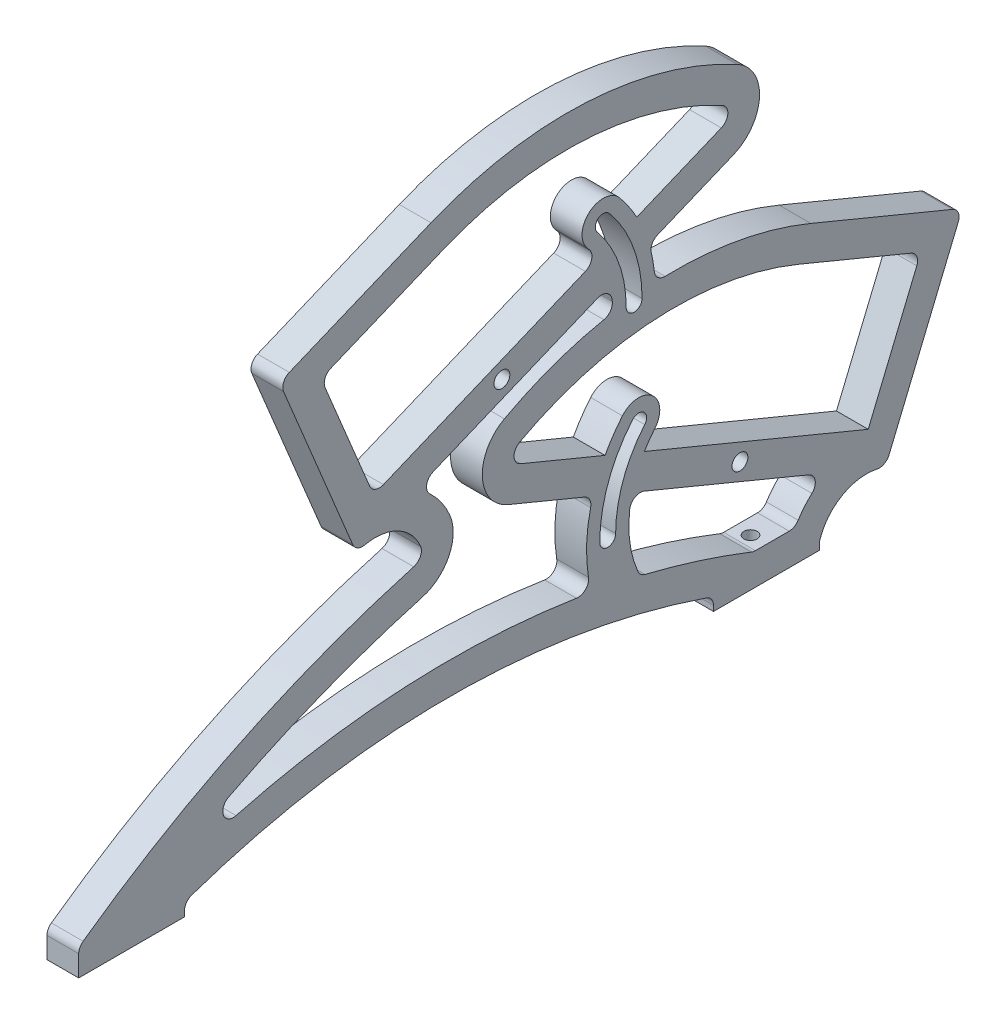
from build123d import *

# Parameters (mm, degrees)
SKETCH1_R                   = 1.5
BOSS_EXTRUDE1_DEPTH         = 6
FILLET1_R                   = 2
TAP_DRILL_FOR_M3_TAP1_D     = 2.5
TAP_DRILL_FOR_M3_TAP1_DEPTH = 10
TAP_DRILL_FOR_M3_TAP1_TIP   = 0.751075774


with BuildPart() as part:
    # Sketch1 → Boss-Extrude1 (new body)
    with BuildSketch(Plane(origin=(0, 0, 0), x_dir=(0, 0, -1), z_dir=(1, 0, 0))):
        with BuildLine():
            Line((0, 0), (0, 5))
            ThreePointArc((0, 5), (30.306872644, 23.131839172), (63.330515184, 35.650191885))
            ThreePointArc((63.330515184, 35.650191885), (64.588559877, 36.701940492), (64.63724154, 38.340989509))
            ThreePointArc((64.63724154, 38.340989509), (59.61305605, 43.365174999), (52.507784789, 43.365174999))
            Line((52.507784789, 43.365174999), (37.965814359, 78.472597235))
            Line((37.965814359, 78.472597235), (66.606079867, 90.335783638))
            ThreePointArc((66.606079867, 90.335783638), (95.908082664, 95.371985071), (124.52441978, 87.305018919))
            ThreePointArc((124.52441978, 87.305018919), (128.697334576, 79.855822577), (123.769732571, 72.882840251))
            Line((123.769732571, 72.882840251), (107.796810512, 66.266639304))
            ThreePointArc((107.796810512, 66.266639304), (108.591313984, 62.851470364), (108.967839824, 59.365377574))
            ThreePointArc((108.967839824, 59.365377574), (123.962972186, 58.5009858), (138.393920133, 54.335783638))
            Line((138.393920133, 54.335783638), (167.034185641, 42.472597235))
            Line((167.034185641, 42.472597235), (152.492215211, 7.365174999))
            ThreePointArc((152.492215211, 7.365174999), (145.029217261, 7.208101321), (140.094434117, 1.607304426))
            ThreePointArc((140.094434117, 1.607304426), (140.023749539, 1.307301346), (140, 1))
            Line((140, 1), (140, 0))
            Line((140, 0), (120, 0))
            Line((120, 0), (120, 1))
            ThreePointArc((120, 1), (119.627466942, 2.162476387), (118.648648649, 2.891891892))
            ThreePointArc((118.648648649, 2.891891892), (70, 11), (21.351351351, 2.891891892))
            ThreePointArc((21.351351351, 2.891891892), (20.372533058, 2.162476387), (20, 1))
            Line((20, 1), (20, 0))
            Line((20, 0), (0, 0))
        make_face()
        with Locations((80, 58)):
            Circle(SKETCH1_R, mode=Mode.SUBTRACT)
        with Locations((125, 22)):
            Circle(SKETCH1_R, mode=Mode.SUBTRACT)
        with BuildLine():
            Line((105.500709917, 71.809916499), (121.473631977, 78.426117447))
            ThreePointArc((121.473631977, 78.426117447), (122.705532478, 80.169363028), (121.662303779, 82.031662113))
            ThreePointArc((121.662303779, 82.031662113), (95.594542214, 89.380182973), (68.902180461, 84.792506443))
            Line((68.902180461, 84.792506443), (45.805192149, 75.225420634))
            Line((45.805192149, 75.225420634), (55.75496139, 51.204552788))
            Line((55.75496139, 51.204552788), (98.054425187, 68.725564374))
            ThreePointArc((98.054425187, 68.725564374), (97.126892249, 70.151936549), (96.086933305, 71.498539803))
            ThreePointArc((96.086933305, 71.498539803), (96.579960639, 77.133868015), (102.21528885, 76.640840681))
            ThreePointArc((102.21528885, 76.640840681), (103.979962296, 74.308323282), (105.500709917, 71.809916499))
        make_face(mode=Mode.SUBTRACT)
        with BuildLine():
            Line((63.72452745, 48.011301935), (100.350525782, 63.182287179))
            ThreePointArc((100.350525782, 63.182287179), (100.807496311, 60.83691686), (100.995074214, 58.454817254))
            ThreePointArc((100.995074214, 58.454817254), (90.445167867, 55.712658084), (80.47558022, 51.305018919))
            ThreePointArc((80.47558022, 51.305018919), (76.302665424, 43.855822577), (81.230267429, 36.882840251))
            Line((81.230267429, 36.882840251), (97.203189488, 30.266639304))
            ThreePointArc((97.203189488, 30.266639304), (96.003949868, 22.478619602), (96.9455023, 14.655263189))
            ThreePointArc((96.9455023, 14.655263189), (53.555187376, 16.130809763), (11.438572835, 5.591006803))
            ThreePointArc((11.438572835, 5.591006803), (37.27128416, 19.770562369), (64.953613309, 29.873899607))
            ThreePointArc((64.953613309, 29.873899607), (69.985792082, 34.080894036), (70.180518735, 40.637090103))
            ThreePointArc((70.180518735, 40.637090103), (67.559666076, 44.855738901), (63.72452745, 48.011301935))
        make_face(mode=Mode.SUBTRACT)
        with BuildLine():
            Line((106.945574813, 32.725564374), (149.24503861, 15.204552788))
            Line((149.24503861, 15.204552788), (159.194807851, 39.225420634))
            Line((159.194807851, 39.225420634), (136.097819539, 48.792506443))
            ThreePointArc((136.097819539, 48.792506443), (109.405457786, 53.380182973), (83.337696221, 46.031662113))
            ThreePointArc((83.337696221, 46.031662113), (82.294467522, 44.169363028), (83.526368023, 42.426117447))
            Line((83.526368023, 42.426117447), (99.499290083, 35.809916499))
            ThreePointArc((99.499290083, 35.809916499), (101.020037704, 38.308323282), (102.78471115, 40.640840681))
            ThreePointArc((102.78471115, 40.640840681), (108.420039361, 41.133868015), (108.913066695, 35.498539803))
            ThreePointArc((108.913066695, 35.498539803), (107.873107751, 34.151936549), (106.945574813, 32.725564374))
        make_face(mode=Mode.SUBTRACT)
        with BuildLine():
            Line((104.649474218, 27.182287179), (141.27547255, 12.011301935))
            ThreePointArc((141.27547255, 12.011301935), (137.950950961, 9.410732752), (135.464526627, 6))
            Line((135.464526627, 6), (127.541289523, 6))
            ThreePointArc((127.541289523, 6), (116.964502802, 9.762681734), (106.144506127, 12.754982379))
            ThreePointArc((106.144506127, 12.754982379), (104.111850842, 19.835461998), (104.649474218, 27.182287179))
        make_face(mode=Mode.SUBTRACT)
        with BuildLine():
            ThreePointArc((106.5, 58), (104.901854451, 67.063533798), (100.300177743, 75.033871657))
            ThreePointArc((100.300177743, 75.033871657), (98.186929663, 75.218756907), (98.002044413, 73.105508828))
            ThreePointArc((98.002044413, 73.105508828), (102.082776588, 66.037473368), (103.5, 58))
            ThreePointArc((103.5, 58), (105, 56.5), (106.5, 58))
        make_face(mode=Mode.SUBTRACT)
        with BuildLine():
            ThreePointArc((104.699822257, 39.033871657), (100.098145549, 31.063533798), (98.5, 22))
            ThreePointArc((98.5, 22), (100, 20.5), (101.5, 22))
            ThreePointArc((101.5, 22), (102.917223412, 30.037473368), (106.997955587, 37.105508828))
            ThreePointArc((106.997955587, 37.105508828), (106.813070337, 39.218756907), (104.699822257, 39.033871657))
        make_face(mode=Mode.SUBTRACT)
    extrude(amount=BOSS_EXTRUDE1_DEPTH)

    # Fillet1
    fillet1_edges = [part.edges().sort_by_distance(p)[0] for p in [
        (3, 75.225420634, -45.805192149),
        (3, 51.204552788, -55.75496139),
        (3, 68.725564374, -98.054425187),
        (3, 58.454817254, -100.995074214),
        (3, 63.182287179, -100.350525782),
        (3, 48.011301935, -63.72452745),
        (3, 5.591006803, -11.438572835),
        (3, 14.655263189, -96.9455023),
        (3, 30.266639304, -97.203189488),
        (3, 27.182287179, -104.649474218),
        (3, 12.754982379, -106.144506127),
        (3, 6, -127.541289523),
        (3, 6, -135.464526627),
        (3, 12.011301935, -141.27547255),
        (3, 5, 0),
        (3, 43.365174999, -52.507784789),
        (3, 78.472597235, -37.965814359),
        (3, 66.266639304, -107.796810512),
        (3, 59.365377574, -108.967839824),
        (3, 42.472597235, -167.034185641),
        (3, 7.365174999, -152.492215211),
        (3, 39.225420634, -159.194807851),
    ]]
    fillet(fillet1_edges, radius=FILLET1_R)

    # Tap Drill for M3 Tap1
    with Locations(Plane(origin=(0, 0, 0), x_dir=(-1, 0, 0), z_dir=(0, -1, 0))):
        with Locations((-3, 10), (-3, 130)):
            Hole(TAP_DRILL_FOR_M3_TAP1_D / 2, depth=TAP_DRILL_FOR_M3_TAP1_DEPTH)
            with Locations((0, 0, -(TAP_DRILL_FOR_M3_TAP1_DEPTH + TAP_DRILL_FOR_M3_TAP1_TIP / 2))):  # 118° drill point
                Cone(0, TAP_DRILL_FOR_M3_TAP1_D / 2, TAP_DRILL_FOR_M3_TAP1_TIP, mode=Mode.SUBTRACT)


solid = part.part
